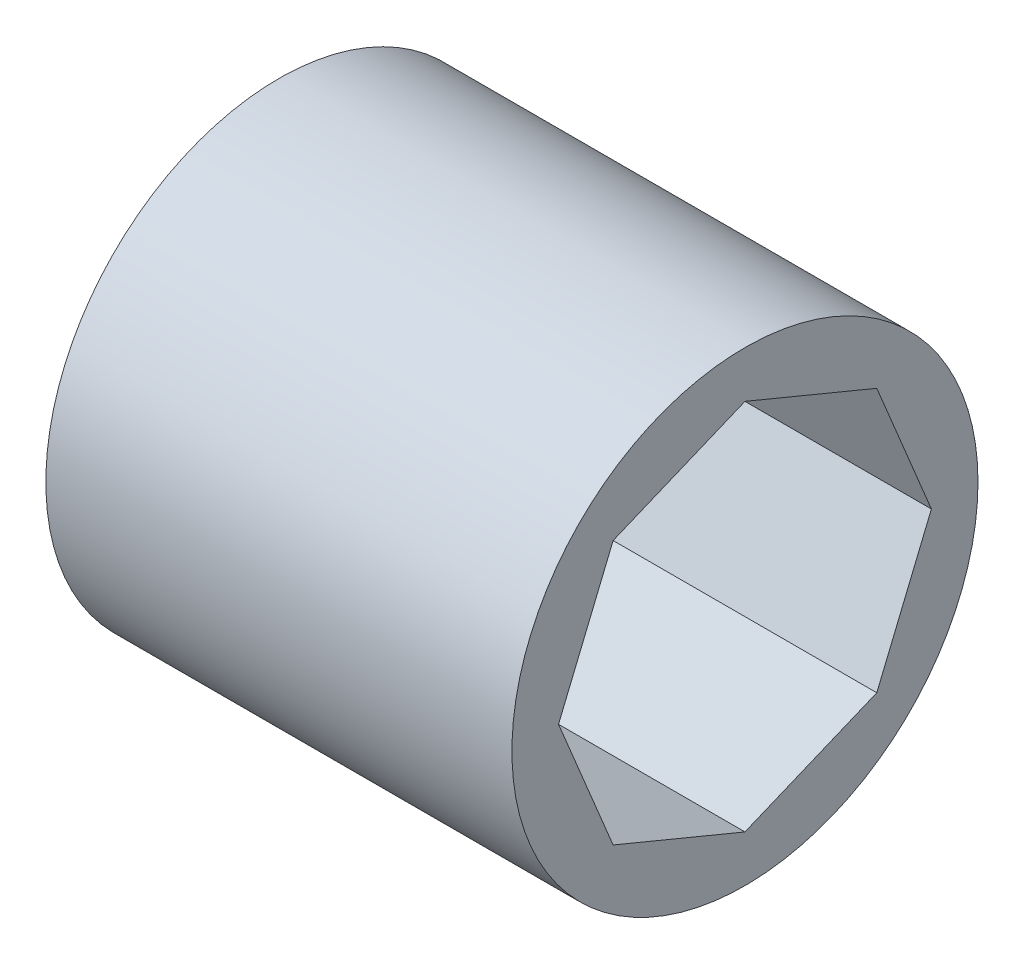
from build123d import *

# Parameters (mm, degrees)
SKETCH2_R           = 10
BOSS_EXTRUDE5_DEPTH = 20
CUT_EXTRUDE1_DEPTH  = 20


with BuildPart() as part:
    # Sketch2 → Boss-Extrude5 (new body)
    with BuildSketch(Plane(origin=(0, 0, 0), x_dir=(0, 0, -1), z_dir=(1, 0, 0))):
        Circle(SKETCH2_R)
    extrude(amount=BOSS_EXTRUDE5_DEPTH)

    # Sketch5 → Cut-Extrude1 (cut)
    with BuildSketch(Plane(origin=(20, 0, 0), x_dir=(0, 0, -1), z_dir=(1, 0, 0))):
        Polygon((8, 0), (5.656854249, 5.656854249), (0, 8), (-5.656854249, 5.656854249), (-8, 0), (-5.656854249, -5.656854249), (0, -8), (5.656854249, -5.656854249), align=None)
    extrude(amount=-CUT_EXTRUDE1_DEPTH, mode=Mode.SUBTRACT)


solid = part.part
